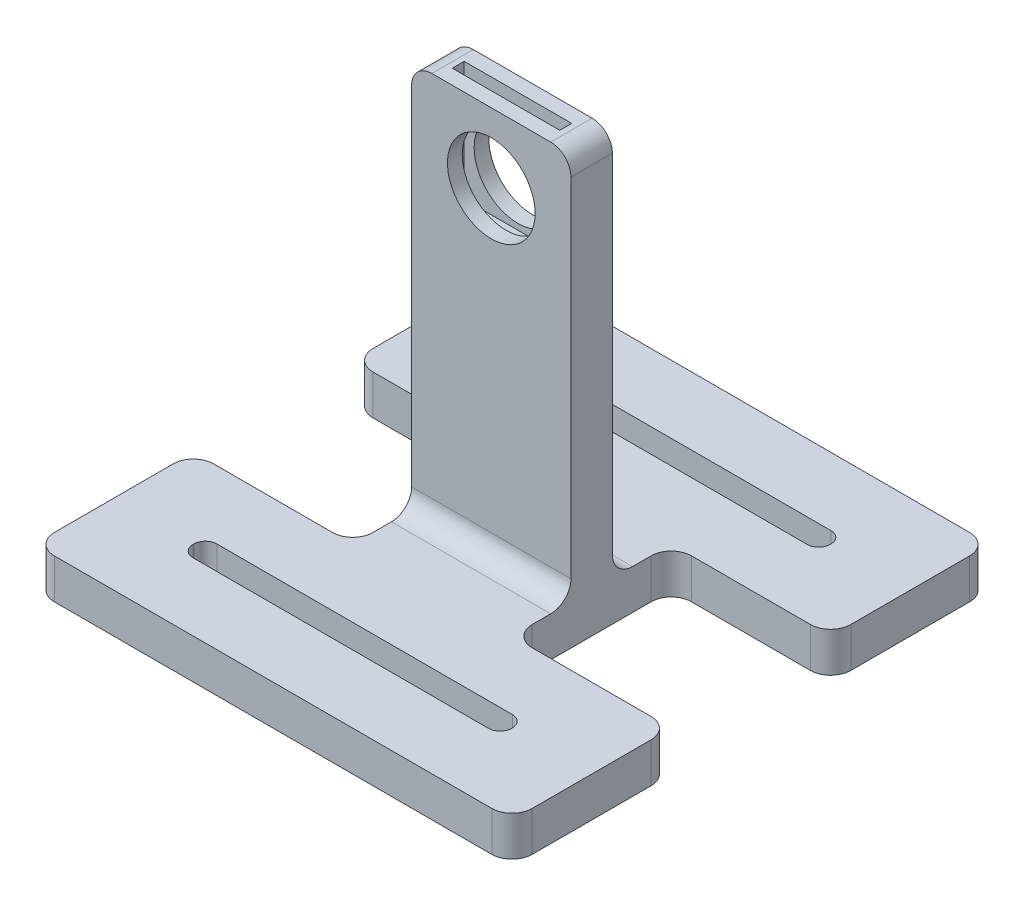
from build123d import *

# Parameters (mm, degrees)
BOSS_EXTRUDE1_DEPTH = 5
CUT_EXTRUDE1_DEPTH  = 43.720018727
FILLET1_R           = 2.54
SKETCH9_W           = 20
SKETCH9_H           = 5.200996356
BOSS_EXTRUDE5_DEPTH = 33.75
SKETCH11_W          = 3.25
SKETCH11_H          = 1.5
BOSS_EXTRUDE6_DEPTH = 15
SKETCH12_R          = 5.5
CUT_EXTRUDE3_DEPTH  = 70.655258104
FILLET3_R           = 2.54


with BuildPart() as part:
    # Sketch1 → Boss-Extrude1 (new body)
    with BuildSketch(Plane(origin=(0, 0, 0), x_dir=(1, 0, 0), z_dir=(0, 1, 0))):
        Polygon((-30, -10), (-30, -30), (30, -30), (30, -10), (10, -10), (10, 10), (30, 10), (30, 30), (-30, 30), (-30, 10), (-10, 10), (-10, -10), align=None)
    extrude(amount=BOSS_EXTRUDE1_DEPTH)

    # Sketch2 → Cut-Extrude1 (cut, through all)
    with BuildSketch(Plane(origin=(0, 5, 0), x_dir=(1, 0, 0), z_dir=(0, 1, 0))):
        with BuildLine():
            Line((-18.55, 18.5), (18.55, 18.5))
            ThreePointArc((18.55, 18.5), (19.575304833, 18.924695167), (20, 19.95))
            Line((20, 19.95), (20, 20.05))
            ThreePointArc((20, 20.05), (19.575304833, 21.075304833), (18.55, 21.5))
            Line((18.55, 21.5), (-18.55, 21.5))
            ThreePointArc((-18.55, 21.5), (-19.575304833, 21.075304833), (-20, 20.05))
            Line((-20, 20.05), (-20, 19.95))
            ThreePointArc((-20, 19.95), (-19.575304833, 18.924695167), (-18.55, 18.5))
        make_face()
        with BuildLine():
            Line((-18.55, -21.5), (18.55, -21.5))
            ThreePointArc((18.55, -21.5), (19.575304833, -21.075304833), (20, -20.05))
            Line((20, -20.05), (20, -19.95))
            ThreePointArc((20, -19.95), (19.575304833, -18.924695167), (18.55, -18.5))
            Line((18.55, -18.5), (-18.55, -18.5))
            ThreePointArc((-18.55, -18.5), (-19.575304833, -18.924695167), (-20, -19.95))
            Line((-20, -19.95), (-20, -20.05))
            ThreePointArc((-20, -20.05), (-19.575304833, -21.075304833), (-18.55, -21.5))
        make_face()
    extrude(amount=-CUT_EXTRUDE1_DEPTH, mode=Mode.SUBTRACT)

    # Fillet1
    fillet1_edges = [part.edges().sort_by_distance(p)[0] for p in [
        (-10, 2.5, -10),
        (-30, 2.5, -10),
        (-30, 2.5, -30),
        (30, 2.5, -30),
        (30, 2.5, -10),
        (10, 2.5, -10),
        (10, 2.5, 10),
        (30, 2.5, 10),
        (30, 2.5, 30),
        (-30, 2.5, 30),
        (-30, 2.5, 10),
        (-10, 2.5, 10),
    ]]
    fillet(fillet1_edges, radius=FILLET1_R)

    # Sketch9 → Boss-Extrude5 (add)
    with BuildSketch(Plane(origin=(0, 5, 0), x_dir=(1, 0, 0), z_dir=(0, 1, 0))):
        Rectangle(SKETCH9_W, SKETCH9_H)
    extrude(amount=BOSS_EXTRUDE5_DEPTH)

    # Sketch11 → Boss-Extrude6 (add)
    with BuildSketch(Plane(origin=(0, 38.75, 0), x_dir=(1, 0, 0), z_dir=(0, 1, 0))):
        Polygon((-10, 2.600498178), (-10, 0.75), (-6.75, 0.75), (6.75, 0.75), (10, 0.75), (10, 2.600498178), align=None)
        with Locations((-8.375, 0)):
            Rectangle(SKETCH11_W, SKETCH11_H)
        Polygon((-6.75, -0.75), (-10, -0.75), (-10, -2.600498178), (10, -2.600498178), (10, -0.75), (6.75, -0.75), align=None)
        with Locations((8.375, 0)):
            Rectangle(SKETCH11_W, SKETCH11_H)
    extrude(amount=BOSS_EXTRUDE6_DEPTH)

    # Sketch12 → Cut-Extrude3 (cut, through all)
    with BuildSketch(Plane.XY.offset(2.600498178)):
        with Locations((0, 45)):
            Circle(SKETCH12_R)
    extrude(amount=-CUT_EXTRUDE3_DEPTH, mode=Mode.SUBTRACT)

    # Fillet3
    fillet3_edges = [part.edges().sort_by_distance(p)[0] for p in [
        (0, 5, -2.600498178),
        (0, 5, 2.600498178),
        (10, 53.75, 0),
        (-10, 53.75, 0),
    ]]
    fillet(fillet3_edges, radius=FILLET3_R)


solid = part.part
